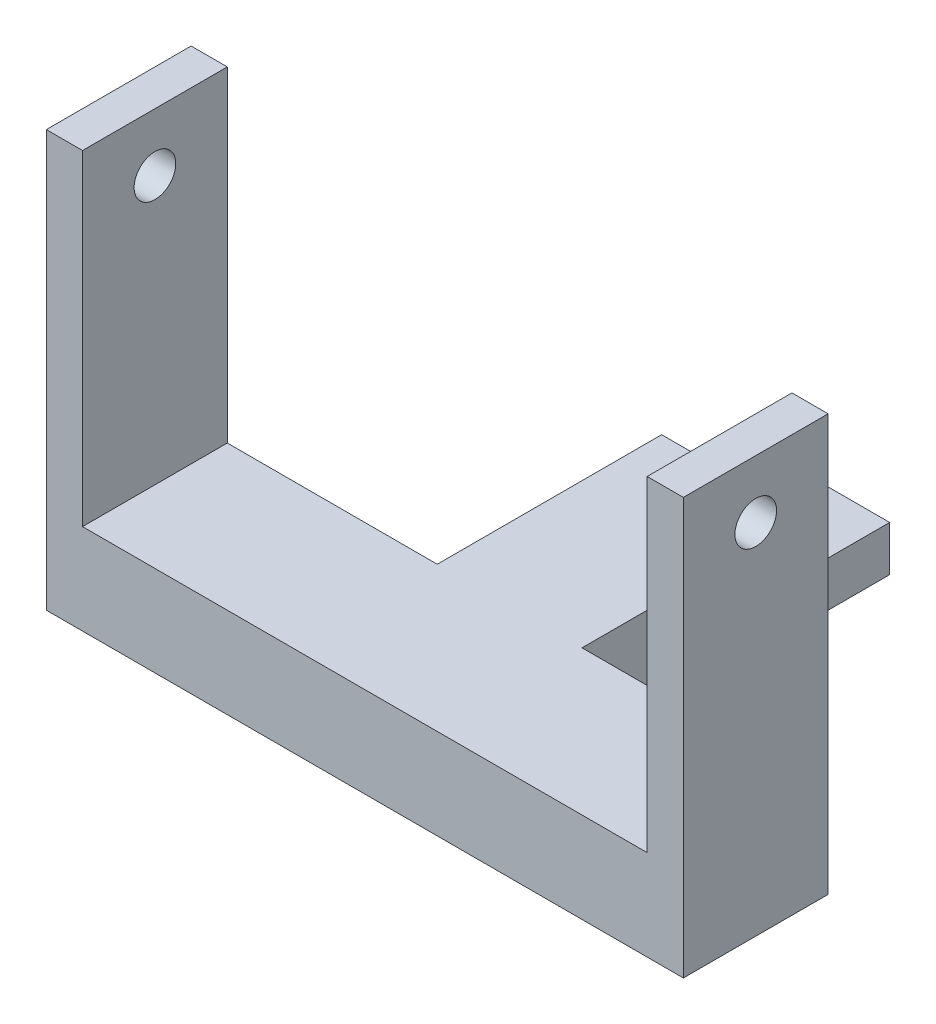
from build123d import *

# Parameters (mm, degrees)
SKETCH_1_W          = 156
SKETCH_1_H          = 40
EXTRUDE_1_DEPTH     = 20
SKETCH_2_W          = 40
SKETCH_2_H          = 20
EXTRUDE_2_DEPTH     = 10
SKETCH_3_W          = 40
SKETCH_3_H          = 20
EXTRUDE_3_DEPTH     = 10
SKETCH_4_W          = 10
SKETCH_4_H          = 40
EXTRUDE_4_DEPTH     = 80
SKETCH_5_W          = 10
SKETCH_5_H          = 40
EXTRUDE_5_DEPTH     = 80
SKETCH_6_R          = 5.75
CUT_EXTRUDE_1_DEPTH = 194
SKETCH_7_W          = 40
SKETCH_7_H          = 40
EXTRUDE_6_DEPTH     = 15
SKETCH_8_W          = 40
SKETCH_8_H          = 25
EXTRUDE_7_DEPTH     = 85
SKETCH_9_W          = 23
SKETCH_9_H          = 12.5
CUT_EXTRUDE_2_DEPTH = 43
SKETCH_10_R         = 2.1
CUT_EXTRUDE_3_DEPTH = 43
SKETCH_11_W         = 68
SKETCH_11_H         = 40
EXTRUDE_8_DEPTH     = 15
SKETCH_12_W         = 68
SKETCH_12_H         = 40
EXTRUDE_9_DEPTH     = 15
SKETCH_13_W         = 156
SKETCH_13_H         = 40
CUT_EXTRUDE_4_DEPTH = 10


with BuildPart() as part:
    # 草图1 → 凸台-拉伸1 (new body)
    with BuildSketch(Plane(origin=(0, 0, 0), x_dir=(1, 0, 0), z_dir=(0, 1, 0))):
        Rectangle(SKETCH_1_W, SKETCH_1_H)
    extrude(amount=EXTRUDE_1_DEPTH)



with BuildPart() as body_2:
    # 草图2 → 凸台-拉伸2 (new body)
    with BuildSketch(Plane.ZY.offset(78)):
        with Locations((0, 10)):
            Rectangle(SKETCH_2_W, SKETCH_2_H)
    extrude(amount=EXTRUDE_2_DEPTH)


with BuildPart() as body_3:
    # 草图3 → 凸台-拉伸3 (new body)
    with BuildSketch(Plane(origin=(78, 0, 0), x_dir=(0, 0, -1), z_dir=(1, 0, 0))):
        with Locations((0, 10)):
            Rectangle(SKETCH_3_W, SKETCH_3_H)
    extrude(amount=EXTRUDE_3_DEPTH)


with BuildPart() as part_1:
    add(part.part)

    add(body_2.part)  # 凸台-拉伸4 merges body 2
    # 草图4 → 凸台-拉伸4 (add)
    with BuildSketch(Plane(origin=(0, 20, 0), x_dir=(1, 0, 0), z_dir=(0, 1, 0))):
        with Locations((-83, 0)):
            Rectangle(SKETCH_4_W, SKETCH_4_H)
    extrude(amount=EXTRUDE_4_DEPTH)


    add(body_3.part)  # 凸台-拉伸5 merges body 3
    # 草图5 → 凸台-拉伸5 (add)
    with BuildSketch(Plane(origin=(0, 20, 0), x_dir=(1, 0, 0), z_dir=(0, 1, 0))):
        with Locations((83, 0)):
            Rectangle(SKETCH_5_W, SKETCH_5_H)
    extrude(amount=EXTRUDE_5_DEPTH)

    # 草图6 → 切除-拉伸1 (cut)
    with BuildSketch(Plane.ZY.offset(88)):
        with Locations((0, 84)):
            Circle(SKETCH_6_R)
    extrude(amount=-CUT_EXTRUDE_1_DEPTH, mode=Mode.SUBTRACT)

    # 草图7 → 凸台-拉伸6 (add)
    with BuildSketch(Plane.XZ):
        Rectangle(SKETCH_7_W, SKETCH_7_H)
    extrude(amount=EXTRUDE_6_DEPTH)

    # 草图8 → 凸台-拉伸7 (add)
    with BuildSketch(Plane(origin=(0, 0, -20), x_dir=(-1, 0, 0), z_dir=(0, 0, -1))):
        with Locations((0, -2.5)):
            Rectangle(SKETCH_8_W, SKETCH_8_H)
    extrude(amount=EXTRUDE_7_DEPTH)

    # 草图9 → 切除-拉伸2 (cut)
    with BuildSketch(Plane.ZY.offset(20)):
        with Locations((-93.5, 3.75)):
            Rectangle(SKETCH_9_W, SKETCH_9_H)
    extrude(amount=-CUT_EXTRUDE_2_DEPTH, mode=Mode.SUBTRACT)

    # 草图10 → 切除-拉伸3 (cut)
    with BuildSketch(Plane(origin=(0, -2.5, 0), x_dir=(1, 0, 0), z_dir=(0, 1, 0))):
        with Locations(Location((0, 93.5, 0), (0, 0, 270))):
            Circle(SKETCH_10_R)
    extrude(amount=-CUT_EXTRUDE_3_DEPTH, mode=Mode.SUBTRACT)

    # 草图11 → 凸台-拉伸8 (add)
    with BuildSketch(Plane.XZ):
        with Locations((54, 0)):
            Rectangle(SKETCH_11_W, SKETCH_11_H)
    extrude(amount=EXTRUDE_8_DEPTH)

    # 草图12 → 凸台-拉伸9 (add)
    with BuildSketch(Plane.XZ):
        with Locations((-54, 0)):
            Rectangle(SKETCH_12_W, SKETCH_12_H)
    extrude(amount=EXTRUDE_9_DEPTH)

    # 草图13 → 切除-拉伸4 (cut)
    with BuildSketch(Plane(origin=(0, 20, 0), x_dir=(1, 0, 0), z_dir=(0, 1, 0))):
        Rectangle(SKETCH_13_W, SKETCH_13_H)
    extrude(amount=-CUT_EXTRUDE_4_DEPTH, mode=Mode.SUBTRACT)


solid = part_1.part
